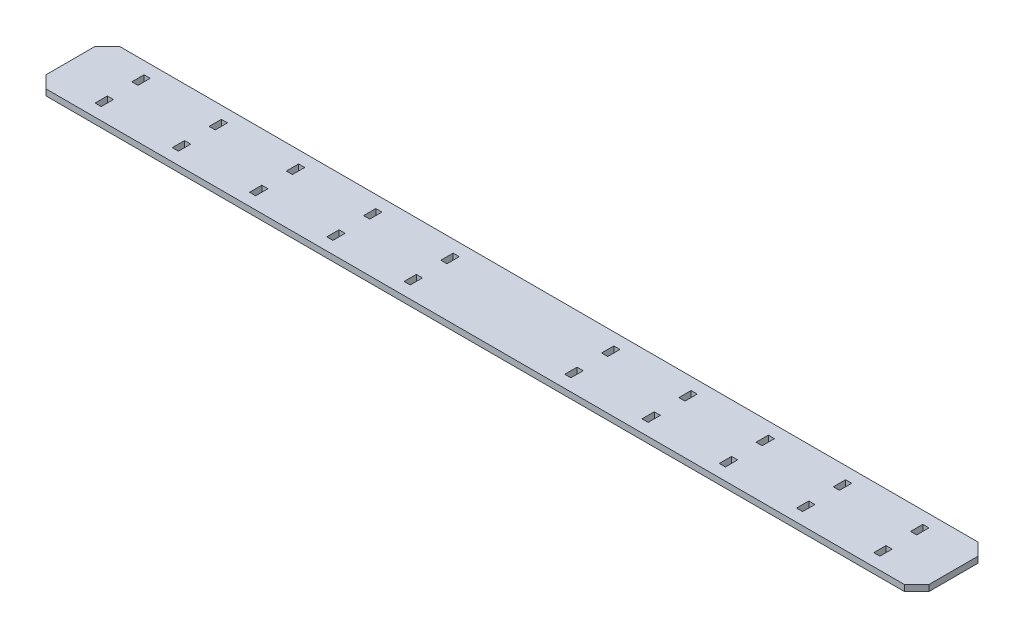
from build123d import *

# Parameters (mm, degrees)
SKETCH1_W           = 457.2
SKETCH1_H           = 38.1
BOSS_EXTRUDE1_DEPTH = 3.175
SKETCH2_W           = 3.175
SKETCH2_H           = 6.35
CUT_EXTRUDE1_DEPTH  = 6.35
CHAMFER1_SIZE       = 6.35


with BuildPart() as part:
    # Sketch1 → Boss-Extrude1 (new body)
    with BuildSketch(Plane(origin=(0, 0, 0), x_dir=(1, 0, 0), z_dir=(0, 1, 0))):
        Rectangle(SKETCH1_W, SKETCH1_H)
    extrude(amount=BOSS_EXTRUDE1_DEPTH)

    # Sketch2 → Cut-Extrude1 (cut)
    with BuildSketch(Plane(origin=(0, 3.175, 0), x_dir=(1, 0, 0), z_dir=(0, 1, 0))):
        with Locations((-201.6125, 9.525)):
            Rectangle(SKETCH2_W, SKETCH2_H)
        with Locations((-201.6125, -9.525)):
            Rectangle(SKETCH2_W, SKETCH2_H)
        with Locations((201.6125, 9.525)):
            Rectangle(SKETCH2_W, SKETCH2_H)
        with Locations((201.6125, -9.525)):
            Rectangle(SKETCH2_W, SKETCH2_H)
        with Locations((-161.6125, 9.525)):
            Rectangle(SKETCH2_W, SKETCH2_H)
        with Locations((-161.6125, -9.525)):
            Rectangle(SKETCH2_W, SKETCH2_H)
        with Locations((-121.6125, 9.525)):
            Rectangle(SKETCH2_W, SKETCH2_H)
        with Locations((-121.6125, -9.525)):
            Rectangle(SKETCH2_W, SKETCH2_H)
        with Locations((-81.6125, 9.525)):
            Rectangle(SKETCH2_W, SKETCH2_H)
        with Locations((-81.6125, -9.525)):
            Rectangle(SKETCH2_W, SKETCH2_H)
        with Locations((-41.6125, 9.525)):
            Rectangle(SKETCH2_W, SKETCH2_H)
        with Locations((-41.6125, -9.525)):
            Rectangle(SKETCH2_W, SKETCH2_H)
        with Locations((41.6125, -9.525)):
            Rectangle(SKETCH2_W, SKETCH2_H)
        with Locations((41.6125, 9.525)):
            Rectangle(SKETCH2_W, SKETCH2_H)
        with Locations((81.6125, -9.525)):
            Rectangle(SKETCH2_W, SKETCH2_H)
        with Locations((81.6125, 9.525)):
            Rectangle(SKETCH2_W, SKETCH2_H)
        with Locations((121.6125, -9.525)):
            Rectangle(SKETCH2_W, SKETCH2_H)
        with Locations((121.6125, 9.525)):
            Rectangle(SKETCH2_W, SKETCH2_H)
        with Locations((161.6125, -9.525)):
            Rectangle(SKETCH2_W, SKETCH2_H)
        with Locations((161.6125, 9.525)):
            Rectangle(SKETCH2_W, SKETCH2_H)
    extrude(amount=-CUT_EXTRUDE1_DEPTH, mode=Mode.SUBTRACT)

    # Chamfer1
    chamfer1_edges = [part.edges().sort_by_distance(p)[0] for p in [
        (228.6, 1.5875, 19.05),
        (-228.6, 1.5875, 19.05),
        (-228.6, 1.5875, -19.05),
        (228.6, 1.5875, -19.05),
    ]]
    chamfer(chamfer1_edges, length=CHAMFER1_SIZE)


solid = part.part
